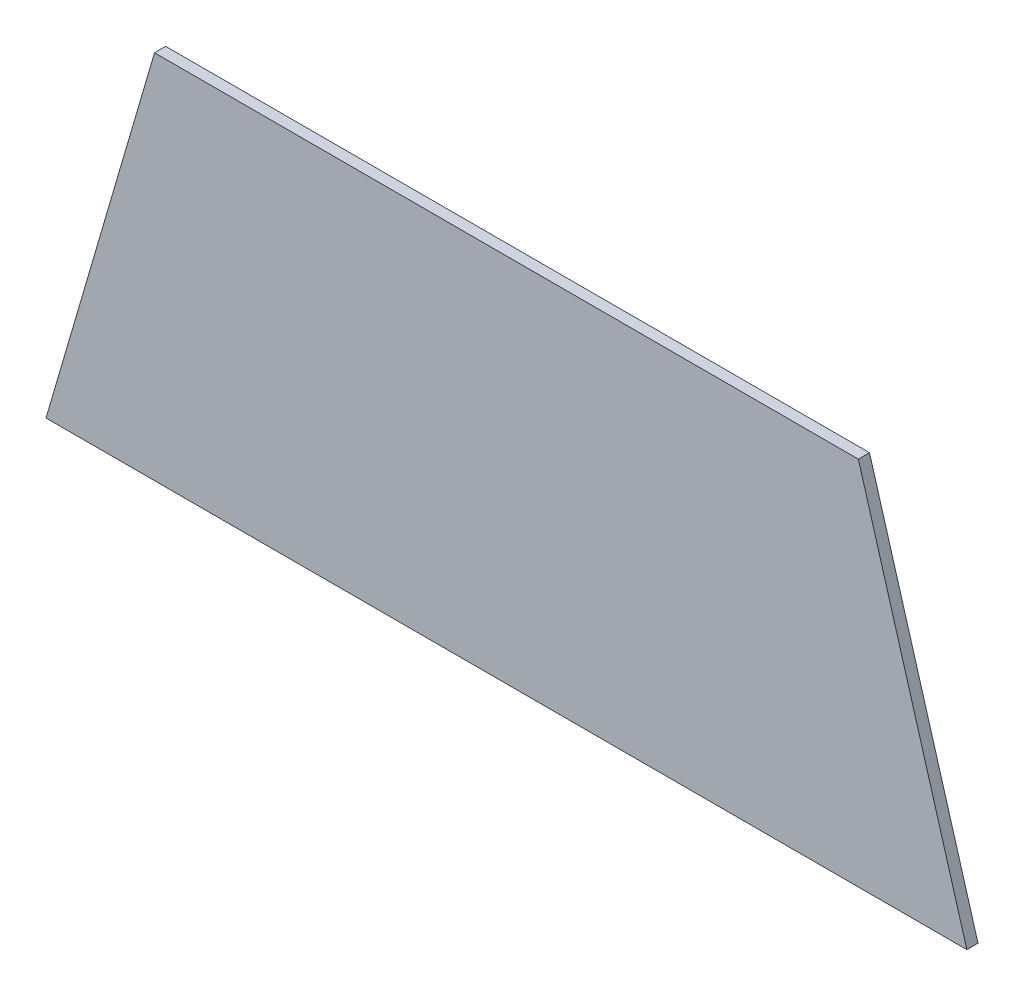
from build123d import *

# Parameters (mm, degrees)
BOSS_EXTRUDE1_DEPTH      = 3
BOSS_EXTRUDE1_DEPTH_BACK = 0.006725904


with BuildPart() as part:
    # Sketch1 → Boss-Extrude1 (new, two sides: drawn at the far end of the back side and taken through both)
    with BuildSketch(Plane.XY.offset(-BOSS_EXTRUDE1_DEPTH_BACK)):
        Polygon((-3.5, 0), (245, 0), (215.720058283, 100), (25.779941717, 100), align=None)
    extrude(amount=BOSS_EXTRUDE1_DEPTH + BOSS_EXTRUDE1_DEPTH_BACK)


solid = part.part
